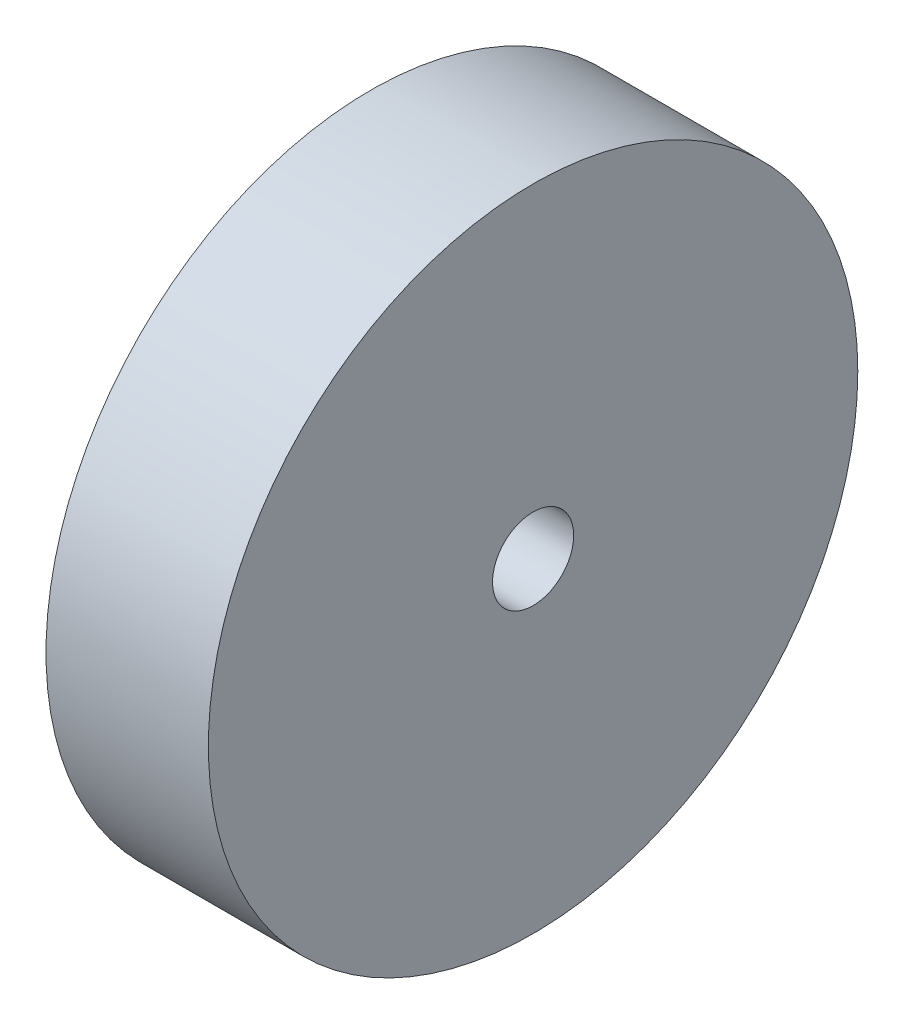
from build123d import *

# Parameters (mm, degrees)
SKETCH1_R           = 25.4
BOSS_EXTRUDE2_DEPTH = 12.7
SKETCH3_R           = 3.175
CUT_EXTRUDE1_DEPTH  = 6.35


with BuildPart() as part:
    # Sketch1 → Boss-Extrude2 (new body)
    with BuildSketch(Plane(origin=(0, 0, 0), x_dir=(0, 0, -1), z_dir=(1, 0, 0))):
        Circle(SKETCH1_R)
    extrude(amount=BOSS_EXTRUDE2_DEPTH)

    # Sketch3 → Cut-Extrude1 (cut)
    with BuildSketch(Plane(origin=(12.7, 0, 0), x_dir=(0, 0, -1), z_dir=(1, 0, 0))):
        Circle(SKETCH3_R)
    extrude(amount=-CUT_EXTRUDE1_DEPTH, mode=Mode.SUBTRACT)


solid = part.part
